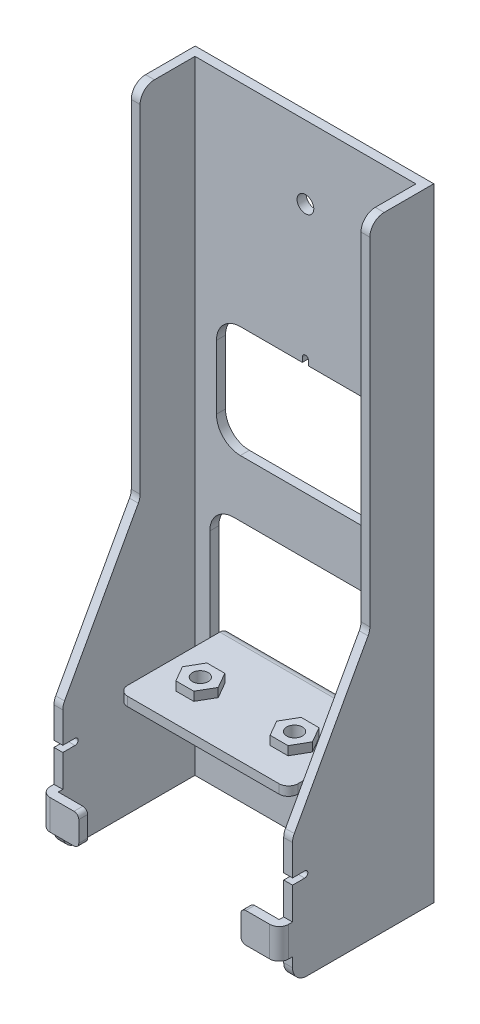
from build123d import *

# Parameters (mm, degrees)
ESQUISSE1_R           = 1.75
BOSS_EXTRU_1_DEPTH    = 1.9
ESQUISSE2_W           = 35.7
ESQUISSE2_H           = 1.9
BOSS_EXTRU_2_DEPTH    = 21.4
CONG_1_R              = 2
CONG_2_R              = 0.2
CONG_3_R              = 2
BOSS_EXTRU_3_DEPTH    = 1.85
TROU_TARAUD_M41_D     = 3.3
BOSS_EXTRU_4_DEPTH    = 1.85
CONG_4_R              = 3
ESQUISSE7_W           = 8
ESQUISSE7_H           = 6.3
BOSS_EXTRU_5_DEPTH    = 1.85
CONG_5_R              = 1
CONG_6_R              = 2
CONG_4_OF_SYM_TRIE1_R = 3
CONG_5_OF_SYM_TRIE1_R = 1
CONG_6_OF_SYM_TRIE1_R = 2


with BuildPart() as part:
    # Esquisse1 → Boss.-Extru.1 (new body)
    with BuildSketch(Plane.XY):
        with BuildLine():
            Line((25, 0), (2.5, 0))
            Line((2.5, 0), (2.5, 2.8))
            ThreePointArc((2.5, 2.8), (0, 5.3), (-2.5, 2.8))
            Line((-2.5, 2.8), (-2.5, 0))
            Line((-2.5, 0), (-25, 0))
            Line((-25, 0), (-25, 130.5))
            Line((-25, 130.5), (25, 130.5))
            Line((25, 130.5), (25, 0))
        make_face()
        with Locations(Location((-18.05, 18.95, 0), (0, 0, 180))):
            Circle(ESQUISSE1_R, mode=Mode.SUBTRACT)
        with Locations(Location((18.05, 18.95, 0), (0, 0, 180))):
            Circle(ESQUISSE1_R, mode=Mode.SUBTRACT)
        with Locations(Location((0, 115.25, 0), (0, 0, 180))):
            Circle(ESQUISSE1_R, mode=Mode.SUBTRACT)
        with BuildLine():
            Line((-17.85, 26), (-17.85, 28.7))
            Line((-17.85, 28.7), (17.85, 28.7))
            Line((17.85, 28.7), (17.85, 26))
            ThreePointArc((17.85, 26), (18.95, 24.9), (20.05, 26))
            Line((20.05, 26), (20.05, 45.9))
            ThreePointArc((20.05, 45.9), (18.585533906, 49.435533906), (15.05, 50.9))
            Line((15.05, 50.9), (-15.05, 50.9))
            ThreePointArc((-15.05, 50.9), (-18.585533906, 49.435533906), (-20.05, 45.9))
            Line((-20.05, 45.9), (-20.05, 26))
            ThreePointArc((-20.05, 26), (-18.95, 24.9), (-17.85, 26))
        make_face(mode=Mode.SUBTRACT)
        with BuildLine():
            Line((-13.65, 86.2), (-0.65, 86.2))
            Line((-0.65, 86.2), (-0.65, 87.2))
            ThreePointArc((-0.65, 87.2), (0, 87.85), (0.65, 87.2))
            Line((0.65, 87.2), (0.65, 86.2))
            Line((0.65, 86.2), (13.65, 86.2))
            ThreePointArc((13.65, 86.2), (17.185533906, 84.735533906), (18.65, 81.2))
            Line((18.65, 81.2), (18.65, 67.8))
            ThreePointArc((18.65, 67.8), (17.185533906, 64.264466094), (13.65, 62.8))
            Line((13.65, 62.8), (-13.65, 62.8))
            ThreePointArc((-13.65, 62.8), (-17.185533906, 64.264466094), (-18.65, 67.8))
            Line((-18.65, 67.8), (-18.65, 81.2))
            ThreePointArc((-18.65, 81.2), (-17.185533906, 84.735533906), (-13.65, 86.2))
        make_face(mode=Mode.SUBTRACT)
    extrude(amount=BOSS_EXTRU_1_DEPTH)

    # Esquisse2 → Boss.-Extru.2 (add)
    with BuildSketch(Plane.XY.offset(1.9)):
        with Locations((0, 27.75)):
            Rectangle(ESQUISSE2_W, ESQUISSE2_H)
    extrude(amount=BOSS_EXTRU_2_DEPTH)

    # Congé1
    cong_1_edges = [part.edges().sort_by_distance(p)[0] for p in [
        (-17.85, 27.75, 23.3),
        (17.85, 27.75, 23.3),
    ]]
    fillet(cong_1_edges, radius=CONG_1_R)

    # Congé2
    cong_2_edges = [part.edges().sort_by_distance(p)[0] for p in [
        (0, 26.8, 1.9),
    ]]
    fillet(cong_2_edges, radius=CONG_2_R)

    # Congé3
    cong_3_edges = [part.edges().sort_by_distance(p)[0] for p in [
        (0, 28.7, 0),
    ]]
    fillet(cong_3_edges, radius=CONG_3_R)

    # Esquisse3 → Boss.-Extru.3 (add)
    with BuildSketch(Plane(origin=(0, 28.7, 0), x_dir=(1, 0, 0), z_dir=(0, 1, 0))):
        Polygon((6.12222325, -14.05), (7.998611625, -17.3), (11.751388375, -17.3), (13.62777675, -14.05), (11.751388375, -10.8), (7.998611625, -10.8), align=None)
        Polygon((-6.12222325, -14.05), (-7.998611625, -10.8), (-11.751388375, -10.8), (-13.62777675, -14.05), (-11.751388375, -17.3), (-7.998611625, -17.3), align=None)
    extrude(amount=BOSS_EXTRU_3_DEPTH)

    # Trou taraudé M41 (through all)
    with Locations(Plane(origin=(0, 30.55, 0), x_dir=(-1, 0, 0), z_dir=(0, 1, 0))):
        with Locations((-9.875, 14.05), (9.875, 14.05)):
            Hole(TROU_TARAUD_M41_D / 2)

    # Esquisse6 → Boss.-Extru.4 (add)
    with BuildSketch(Plane.ZY.offset(25)):
        with BuildLine():
            Line((13.4, 130.5), (13.4, 56))
            Line((13.4, 56), (29.6, 26.5))
            Line((29.6, 26.5), (29.6, 19.3))
            Line((29.6, 19.3), (27.05, 19.3))
            ThreePointArc((27.05, 19.3), (26.4, 18.65), (27.05, 18))
            Line((27.05, 18), (29.6, 18))
            Line((29.6, 18), (29.6, 11.3))
            Line((29.6, 11.3), (32.4, 11.3))
            Line((32.4, 11.3), (32.4, 5))
            Line((32.4, 5), (29.6, 5))
            Line((29.6, 5), (29.6, 0))
            Line((29.6, 0), (0, 0))
            Line((0, 0), (0, 130.5))
            Line((0, 130.5), (13.4, 130.5))
        make_face()
    boss_extru_4 = extrude(amount=-BOSS_EXTRU_4_DEPTH)

    # Congé4
    cong_4_edges = [part.edges().sort_by_distance(p)[0] for p in [
        (-24.075, 130.5, 13.4),
        (-24.075, 56, 13.4),
        (-24.075, 26.5, 29.6),
        (-24.075, 0, 29.6),
    ]]
    fillet(cong_4_edges, radius=CONG_4_R)

    # Esquisse7 → Boss.-Extru.5 (add)
    with BuildSketch(Plane.XY.offset(32.4)):
        with Locations((-21, 8.15)):
            Rectangle(ESQUISSE7_W, ESQUISSE7_H)
    boss_extru_5 = extrude(amount=-BOSS_EXTRU_5_DEPTH)

    # Congé5
    cong_5_edges = [part.edges().sort_by_distance(p)[0] for p in [
        (-17, 5, 31.475),
        (-17, 11.3, 31.475),
    ]]
    fillet(cong_5_edges, radius=CONG_5_R)

    # Congé6
    cong_6_edges = [part.edges().sort_by_distance(p)[0] for p in [
        (-25, 8.15, 32.4),
    ]]
    fillet(cong_6_edges, radius=CONG_6_R)

    # Symétrie1: Boss.-Extru.4, Boss.-Extru.5 across plane
    add(boss_extru_4.mirror(Plane(origin=(0, 0, 0), x_dir=(0, 0, 1), z_dir=(1, 0, 0))))
    add(boss_extru_5.mirror(Plane(origin=(0, 0, 0), x_dir=(0, 0, 1), z_dir=(1, 0, 0))))

    # Congé4 of Symétrie1
    cong_4_of_sym_trie1_edges = [part.edges().sort_by_distance(p)[0] for p in [
        (24.075, 130.5, 13.4),
        (24.075, 56, 13.4),
        (24.075, 26.5, 29.6),
        (24.075, 0, 29.6),
    ]]
    fillet(cong_4_of_sym_trie1_edges, radius=CONG_4_OF_SYM_TRIE1_R)

    # Congé5 of Symétrie1
    cong_5_of_sym_trie1_edges = [part.edges().sort_by_distance(p)[0] for p in [
        (17, 5, 31.475),
        (17, 11.3, 31.475),
    ]]
    fillet(cong_5_of_sym_trie1_edges, radius=CONG_5_OF_SYM_TRIE1_R)

    # Congé6 of Symétrie1
    cong_6_of_sym_trie1_edges = [part.edges().sort_by_distance(p)[0] for p in [
        (25, 8.15, 32.4),
    ]]
    fillet(cong_6_of_sym_trie1_edges, radius=CONG_6_OF_SYM_TRIE1_R)


solid = part.part
